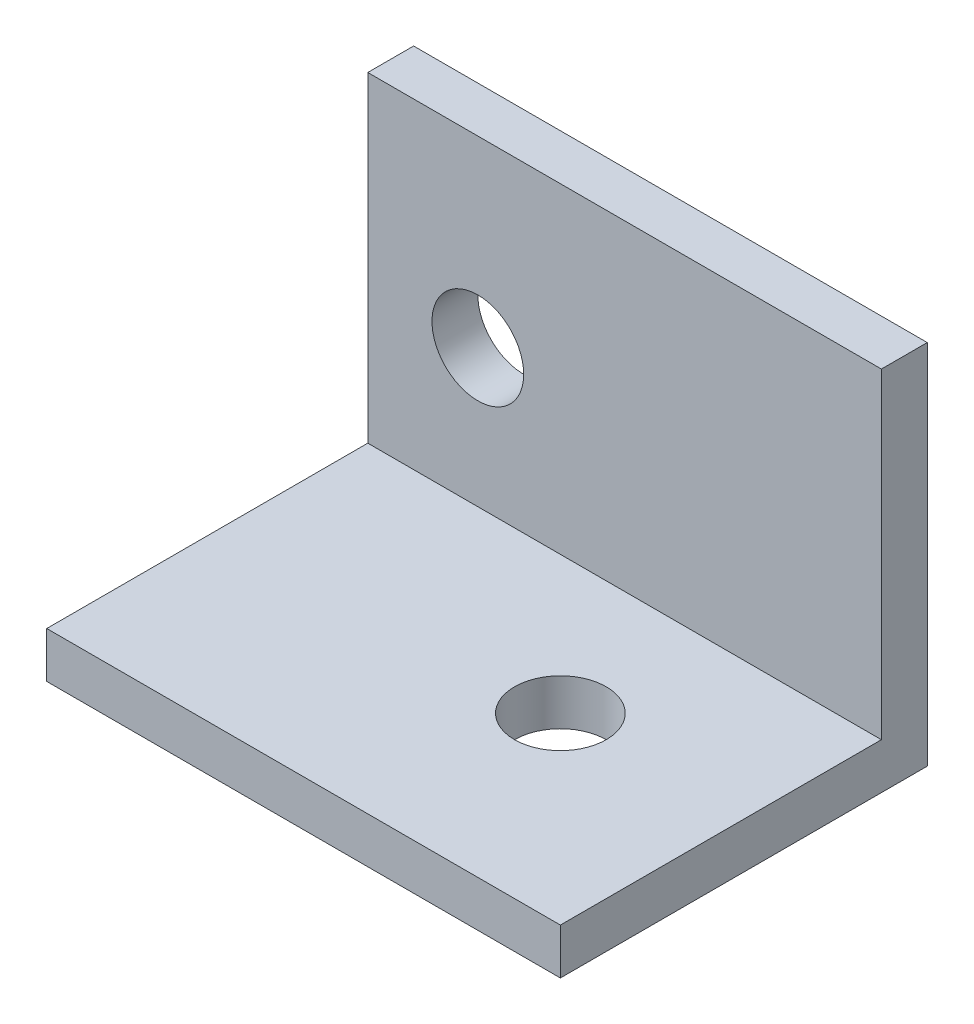
from build123d import *

# Parameters (mm, degrees)
SKETCH1_W           = 35.56
SKETCH1_H           = 25.4
BOSS_EXTRUDE1_DEPTH = 3.175
SKETCH2_W           = 35.56
SKETCH2_H           = 3.175
BOSS_EXTRUDE2_DEPTH = 22.225
SKETCH3_R           = 3.175
CUT_EXTRUDE1_DEPTH  = 3.175
SKETCH4_R           = 3.175
CUT_EXTRUDE2_DEPTH  = 3.175


with BuildPart() as part:
    # Sketch1 → Boss-Extrude1 (new body)
    with BuildSketch(Plane(origin=(0, 0, 0), x_dir=(1, 0, 0), z_dir=(0, 1, 0))):
        Rectangle(SKETCH1_W, SKETCH1_H)
    extrude(amount=BOSS_EXTRUDE1_DEPTH)

    # Sketch2 → Boss-Extrude2 (add)
    with BuildSketch(Plane(origin=(0, 3.175, 0), x_dir=(1, 0, 0), z_dir=(0, 1, 0))):
        with Locations((0, 11.1125)):
            Rectangle(SKETCH2_W, SKETCH2_H)
    extrude(amount=BOSS_EXTRUDE2_DEPTH)

    # Sketch3 → Cut-Extrude1 (cut)
    with BuildSketch(Plane(origin=(0, 3.175, 0), x_dir=(1, 0, 0), z_dir=(0, 1, 0))):
        with Locations(Location((5.08, 0, 0), (0, 0, 270))):
            Circle(SKETCH3_R)
    extrude(amount=-CUT_EXTRUDE1_DEPTH, mode=Mode.SUBTRACT)

    # Sketch4 → Cut-Extrude2 (cut)
    with BuildSketch(Plane.XY.offset(-9.525)):
        with Locations((-10.16, 12.7)):
            Circle(SKETCH4_R)
    extrude(amount=-CUT_EXTRUDE2_DEPTH, mode=Mode.SUBTRACT)


solid = part.part
